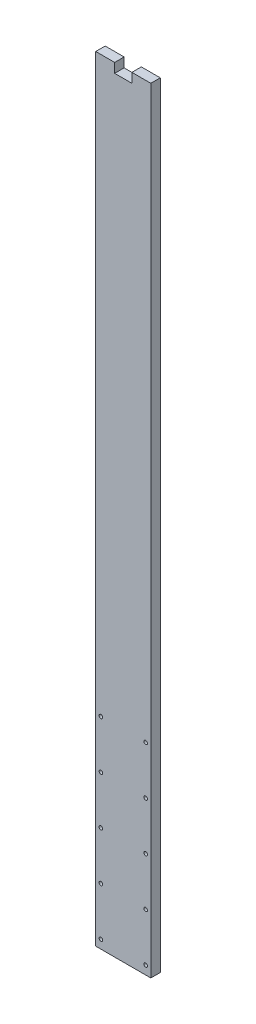
from build123d import *

# Parameters (mm, degrees)
SKETCH_1_W          = 32
SKETCH_1_H          = 450
EXTRUDE_1_DEPTH     = 5.5
SKETCH_2_W          = 10
SKETCH_2_H          = 5.5
CUT_EXTRUDE_1_DEPTH = 5.5
SKETCH_3_R          = 1.05
CUT_EXTRUDE_2_DEPTH = 10


with BuildPart() as part:
    # ｽｹｯﾁ1 → ﾎﾞｽ - 押し出し1 (new body)
    with BuildSketch(Plane.XY):
        with Locations((16, 225)):
            Rectangle(SKETCH_1_W, SKETCH_1_H)
    extrude(amount=EXTRUDE_1_DEPTH)

    # ｽｹｯﾁ2 → ｶｯﾄ - 押し出し1 (cut)
    with BuildSketch(Plane.XY.offset(5.5)):
        with Locations((16, 447.25)):
            Rectangle(SKETCH_2_W, SKETCH_2_H)
    extrude(amount=-CUT_EXTRUDE_1_DEPTH, mode=Mode.SUBTRACT)

    # ｽｹｯﾁ3 → ｶｯﾄ - 押し出し2 (cut)
    with BuildSketch(Plane.XY.offset(5.5)):
        with Locations((3, 5)):
            Circle(SKETCH_3_R)
        with Locations((29, 5)):
            Circle(SKETCH_3_R)
        with Locations((3, 33)):
            Circle(SKETCH_3_R)
        with Locations((29, 33)):
            Circle(SKETCH_3_R)
        with Locations((3, 61)):
            Circle(SKETCH_3_R)
        with Locations((29, 61)):
            Circle(SKETCH_3_R)
        with Locations((3, 89)):
            Circle(SKETCH_3_R)
        with Locations((29, 89)):
            Circle(SKETCH_3_R)
        with Locations((3, 117)):
            Circle(SKETCH_3_R)
        with Locations((29, 117)):
            Circle(SKETCH_3_R)
    extrude(amount=-CUT_EXTRUDE_2_DEPTH, mode=Mode.SUBTRACT)


solid = part.part
